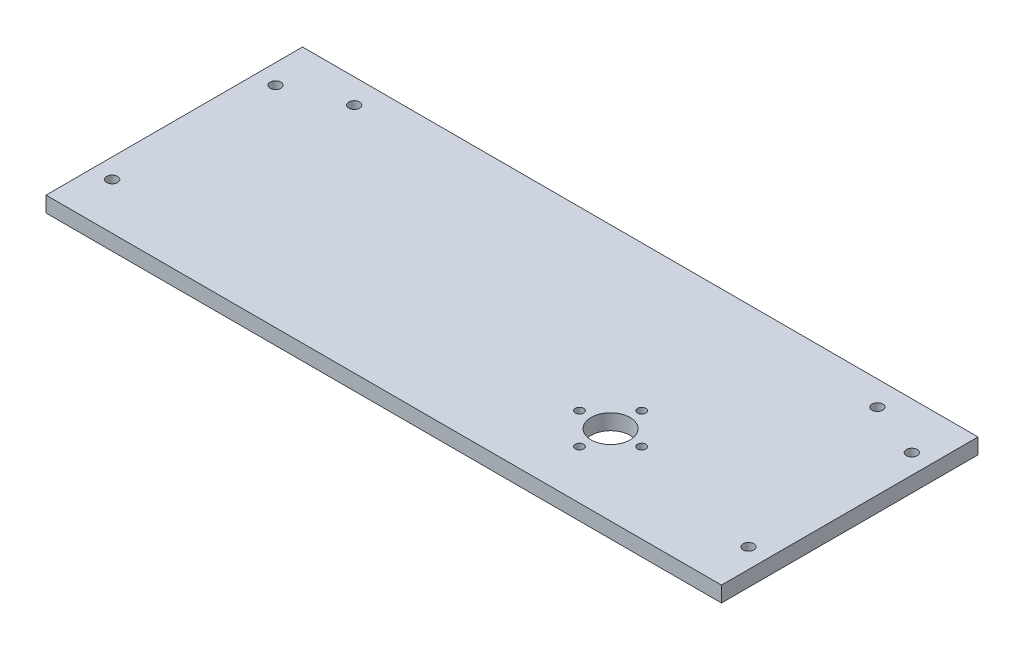
from build123d import *

# Parameters (mm, degrees)
SKETCH1_W           = 276
SKETCH1_H           = 104.826000086
BOSS_EXTRUDE1_DEPTH = 6.35
CUT_EXTRUDE1_REACH  = 149.755
SKETCH2_R           = 2.2
CUT_EXTRUDE2_REACH  = 149.755
SKETCH3_R           = 2.2
CUT_EXTRUDE3_REACH  = 149.755
SKETCH4_R           = 7.9629
CUT_EXTRUDE4_REACH  = 149.755
SKETCH5_R           = 1.7


with BuildPart() as part:
    # Sketch1 → Boss-Extrude1 (new body)
    with BuildSketch(Plane(origin=(0, 0, 0), x_dir=(1, 0, 0), z_dir=(0, 1, 0))):
        Rectangle(SKETCH1_W, SKETCH1_H)
    extrude(amount=BOSS_EXTRUDE1_DEPTH)

    # Sketch2 → Cut-Extrude1 (cut, up to next)
    with BuildSketch(Plane(origin=(0, 6.35, 0), x_dir=(1, 0, 0), z_dir=(0, 1, 0)), mode=Mode.PRIVATE) as cut_extrude1_sk1:
        with Locations(Location((-130, 33.363000043, 0), (0, 0, 270))):
            Circle(SKETCH2_R)
    cut_extrude1_tool1 = extrude(cut_extrude1_sk1.sketch, amount=-CUT_EXTRUDE1_REACH, mode=Mode.PRIVATE) & part.part
    # Sketch2 → Cut-Extrude1 (cut, up to next)
    with BuildSketch(Plane(origin=(0, 6.35, 0), x_dir=(1, 0, 0), z_dir=(0, 1, 0)), mode=Mode.PRIVATE) as cut_extrude1_sk2:
        with Locations(Location((-130, -33.363000043, 0), (0, 0, 270))):
            Circle(SKETCH2_R)
    cut_extrude1_tool2 = extrude(cut_extrude1_sk2.sketch, amount=-CUT_EXTRUDE1_REACH, mode=Mode.PRIVATE) & part.part
    # Sketch2 → Cut-Extrude1 (cut, up to next)
    with BuildSketch(Plane(origin=(0, 6.35, 0), x_dir=(1, 0, 0), z_dir=(0, 1, 0)), mode=Mode.PRIVATE) as cut_extrude1_sk3:
        with Locations(Location((130, -33.363000043, 0), (0, 0, 270))):
            Circle(SKETCH2_R)
    cut_extrude1_tool3 = extrude(cut_extrude1_sk3.sketch, amount=-CUT_EXTRUDE1_REACH, mode=Mode.PRIVATE) & part.part
    # Sketch2 → Cut-Extrude1 (cut, up to next)
    with BuildSketch(Plane(origin=(0, 6.35, 0), x_dir=(1, 0, 0), z_dir=(0, 1, 0)), mode=Mode.PRIVATE) as cut_extrude1_sk4:
        with Locations(Location((130, 33.363000043, 0), (0, 0, 270))):
            Circle(SKETCH2_R)
    cut_extrude1_tool4 = extrude(cut_extrude1_sk4.sketch, amount=-CUT_EXTRUDE1_REACH, mode=Mode.PRIVATE) & part.part
    add(cut_extrude1_tool1.solids().sort_by_distance((-130, 6.35, -33.363))[0], mode=Mode.SUBTRACT)
    add(cut_extrude1_tool2.solids().sort_by_distance((-130, 6.35, 33.363))[0], mode=Mode.SUBTRACT)
    add(cut_extrude1_tool3.solids().sort_by_distance((130, 6.35, 33.363))[0], mode=Mode.SUBTRACT)
    add(cut_extrude1_tool4.solids().sort_by_distance((130, 6.35, -33.363))[0], mode=Mode.SUBTRACT)

    # Sketch3 → Cut-Extrude2 (cut, up to next)
    with BuildSketch(Plane(origin=(0, 6.35, 0), x_dir=(1, 0, 0), z_dir=(0, 1, 0)), mode=Mode.PRIVATE) as cut_extrude2_sk1:
        with Locations(Location((-106.885, 42.413000043, 0), (0, 0, 270))):
            Circle(SKETCH3_R)
    cut_extrude2_tool1 = extrude(cut_extrude2_sk1.sketch, amount=-CUT_EXTRUDE2_REACH, mode=Mode.PRIVATE) & part.part
    # Sketch3 → Cut-Extrude2 (cut, up to next)
    with BuildSketch(Plane(origin=(0, 6.35, 0), x_dir=(1, 0, 0), z_dir=(0, 1, 0)), mode=Mode.PRIVATE) as cut_extrude2_sk2:
        with Locations(Location((106.885, 42.413000043, 0), (0, 0, 270))):
            Circle(SKETCH3_R)
    cut_extrude2_tool2 = extrude(cut_extrude2_sk2.sketch, amount=-CUT_EXTRUDE2_REACH, mode=Mode.PRIVATE) & part.part
    add(cut_extrude2_tool1.solids().sort_by_distance((-106.885, 6.35, -42.413))[0], mode=Mode.SUBTRACT)
    add(cut_extrude2_tool2.solids().sort_by_distance((106.885, 6.35, -42.413))[0], mode=Mode.SUBTRACT)

    # Sketch4 → Cut-Extrude3 (cut, up to next)
    with BuildSketch(Plane(origin=(0, 6.35, 0), x_dir=(1, 0, 0), z_dir=(0, 1, 0)), mode=Mode.PRIVATE) as cut_extrude3_sk1:
        with Locations(Location((60, -19.718000155, 0), (0, 0, 270))):
            Circle(SKETCH4_R)
    cut_extrude3_tool1 = extrude(cut_extrude3_sk1.sketch, amount=-CUT_EXTRUDE3_REACH, mode=Mode.PRIVATE) & part.part
    add(cut_extrude3_tool1.solids().sort_by_distance((60, 6.35, 19.718))[0], mode=Mode.SUBTRACT)

    # Sketch5 → Cut-Extrude4 (cut, up to next)
    with BuildSketch(Plane(origin=(0, 6.35, 0), x_dir=(1, 0, 0), z_dir=(0, 1, 0)), mode=Mode.PRIVATE) as cut_extrude4_sk1:
        with Locations(Location((60, -7.018000155, 0), (0, 0, 270))):
            Circle(SKETCH5_R)
    cut_extrude4_tool1 = extrude(cut_extrude4_sk1.sketch, amount=-CUT_EXTRUDE4_REACH, mode=Mode.PRIVATE) & part.part
    # Sketch5 → Cut-Extrude4 (cut, up to next)
    with BuildSketch(Plane(origin=(0, 6.35, 0), x_dir=(1, 0, 0), z_dir=(0, 1, 0)), mode=Mode.PRIVATE) as cut_extrude4_sk2:
        with Locations(Location((72.7, -19.718000155, 0), (0, 0, 270))):
            Circle(SKETCH5_R)
    cut_extrude4_tool2 = extrude(cut_extrude4_sk2.sketch, amount=-CUT_EXTRUDE4_REACH, mode=Mode.PRIVATE) & part.part
    # Sketch5 → Cut-Extrude4 (cut, up to next)
    with BuildSketch(Plane(origin=(0, 6.35, 0), x_dir=(1, 0, 0), z_dir=(0, 1, 0)), mode=Mode.PRIVATE) as cut_extrude4_sk3:
        with Locations(Location((60, -32.418000155, 0), (0, 0, 270))):
            Circle(SKETCH5_R)
    cut_extrude4_tool3 = extrude(cut_extrude4_sk3.sketch, amount=-CUT_EXTRUDE4_REACH, mode=Mode.PRIVATE) & part.part
    # Sketch5 → Cut-Extrude4 (cut, up to next)
    with BuildSketch(Plane(origin=(0, 6.35, 0), x_dir=(1, 0, 0), z_dir=(0, 1, 0)), mode=Mode.PRIVATE) as cut_extrude4_sk4:
        with Locations(Location((47.3, -19.718000155, 0), (0, 0, 270))):
            Circle(SKETCH5_R)
    cut_extrude4_tool4 = extrude(cut_extrude4_sk4.sketch, amount=-CUT_EXTRUDE4_REACH, mode=Mode.PRIVATE) & part.part
    add(cut_extrude4_tool1.solids().sort_by_distance((60, 6.35, 7.018))[0], mode=Mode.SUBTRACT)
    add(cut_extrude4_tool2.solids().sort_by_distance((72.7, 6.35, 19.718))[0], mode=Mode.SUBTRACT)
    add(cut_extrude4_tool3.solids().sort_by_distance((60, 6.35, 32.418))[0], mode=Mode.SUBTRACT)
    add(cut_extrude4_tool4.solids().sort_by_distance((47.3, 6.35, 19.718))[0], mode=Mode.SUBTRACT)


solid = part.part
